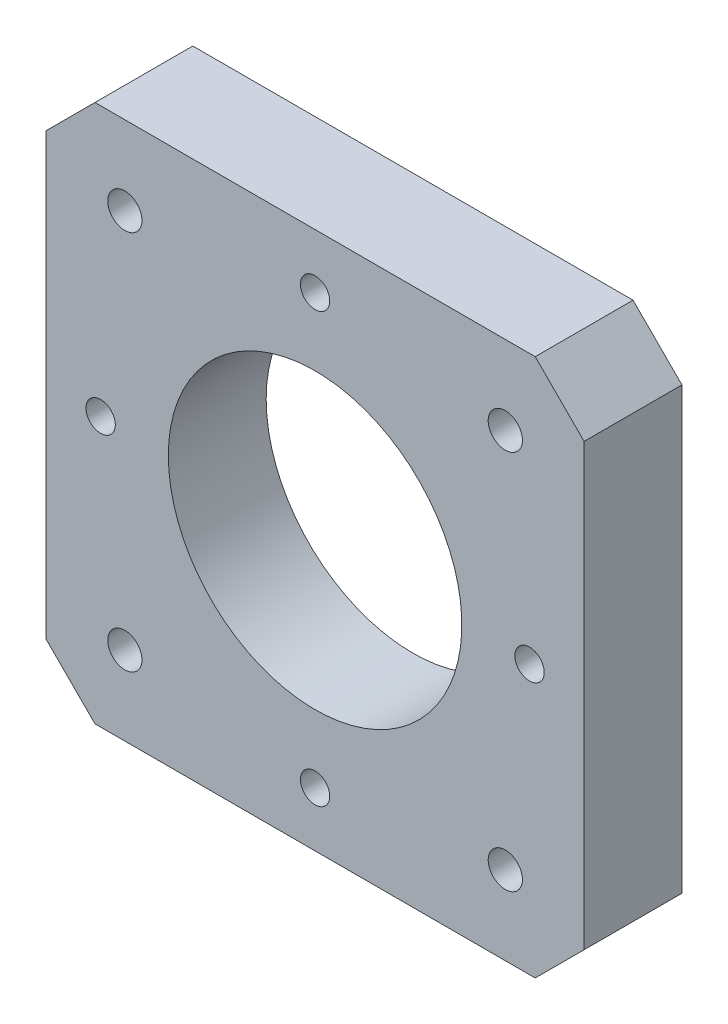
from build123d import *

# Parameters (mm, degrees)
SKETCH1_W           = 55
SKETCH1_H           = 55
SKETCH1_R           = 1.75
BOSS_EXTRUDE1_DEPTH = 10
SKETCH2_R           = 15
CUT_EXTRUDE1_DEPTH  = 41.155946011
SKETCH3_R           = 1.5
CUT_EXTRUDE2_DEPTH  = 41.155946011
SKETCH4_R           = 3.25
CUT_EXTRUDE3_DEPTH  = 6
CHAMFER1_SIZE       = 5


with BuildPart() as part:
    # Sketch1 → Boss-Extrude1 (new body)
    with BuildSketch(Plane.XY):
        Rectangle(SKETCH1_W, SKETCH1_H)
        with Locations((19.445436483, 19.445436483)):
            Circle(SKETCH1_R, mode=Mode.SUBTRACT)
        with Locations((-19.445436483, 19.445436483)):
            Circle(SKETCH1_R, mode=Mode.SUBTRACT)
        with Locations((-19.445436483, -19.445436483)):
            Circle(SKETCH1_R, mode=Mode.SUBTRACT)
        with Locations((19.445436483, -19.445436483)):
            Circle(SKETCH1_R, mode=Mode.SUBTRACT)
    extrude(amount=BOSS_EXTRUDE1_DEPTH)

    # Sketch2 → Cut-Extrude1 (cut, through all)
    with BuildSketch(Plane(origin=(0, 0, 0), x_dir=(-1, 0, 0), z_dir=(0, 0, -1))):
        Circle(SKETCH2_R)
    extrude(amount=-CUT_EXTRUDE1_DEPTH, mode=Mode.SUBTRACT)

    # Sketch3 → Cut-Extrude2 (cut, through all)
    with BuildSketch(Plane(origin=(0, 0, 0), x_dir=(-1, 0, 0), z_dir=(0, 0, -1))):
        with Locations((0, 21.920310217)):
            Circle(SKETCH3_R)
        with Locations((21.920310217, 0)):
            Circle(SKETCH3_R)
        with Locations((0, -21.920310217)):
            Circle(SKETCH3_R)
        with Locations((-21.920310217, 0)):
            Circle(SKETCH3_R)
    extrude(amount=-CUT_EXTRUDE2_DEPTH, mode=Mode.SUBTRACT)

    # Sketch4 → Cut-Extrude3 (cut)
    with BuildSketch(Plane(origin=(0, 0, 0), x_dir=(-1, 0, 0), z_dir=(0, 0, -1))):
        with Locations((0, 21.920310217)):
            Circle(SKETCH4_R)
        with Locations((21.920310217, 0)):
            Circle(SKETCH4_R)
        with Locations((0, -21.920310217)):
            Circle(SKETCH4_R)
        with Locations((-21.920310217, 0)):
            Circle(SKETCH4_R)
    extrude(amount=-CUT_EXTRUDE3_DEPTH, mode=Mode.SUBTRACT)

    # Chamfer1
    chamfer1_edges = [part.edges().sort_by_distance(p)[0] for p in [
        (27.5, -27.5, 5),
        (-27.5, -27.5, 5),
        (-27.5, 27.5, 5),
        (27.5, 27.5, 5),
    ]]
    chamfer(chamfer1_edges, length=CHAMFER1_SIZE)


solid = part.part
